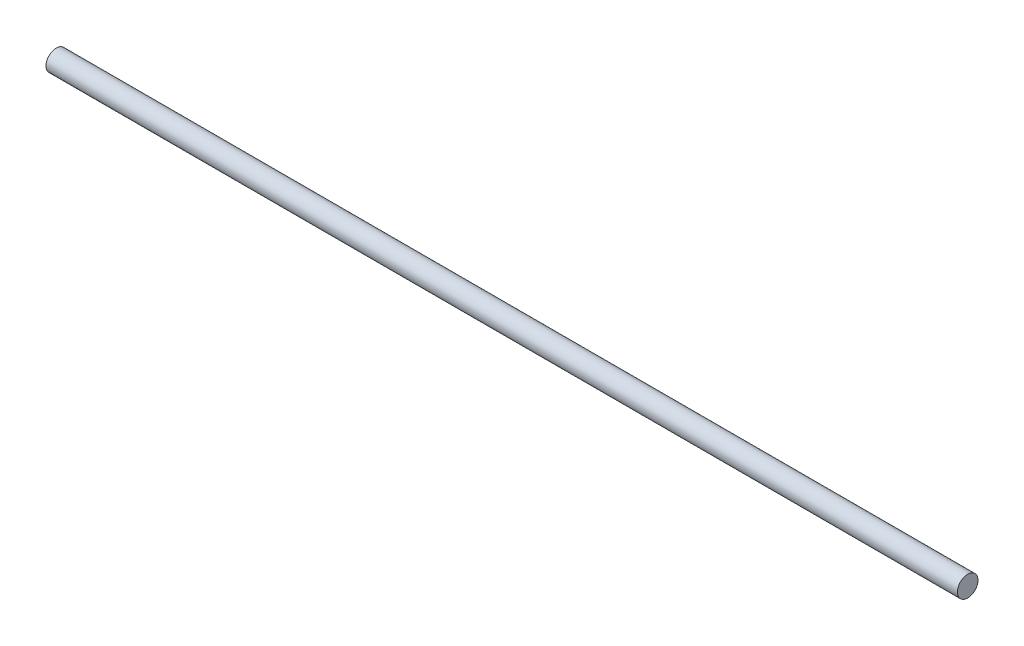
from build123d import *

# Parameters (mm, degrees)
SKETCH1_R           = 9
BOSS_EXTRUDE1_DEPTH = 398


with BuildPart() as part:
    # Sketch1 → Boss-Extrude1 (new, symmetric)
    with BuildSketch(Plane(origin=(0, 0, 0), x_dir=(0, 0, -1), z_dir=(1, 0, 0))):
        Circle(SKETCH1_R)
    extrude(amount=BOSS_EXTRUDE1_DEPTH, both=True)


solid = part.part
